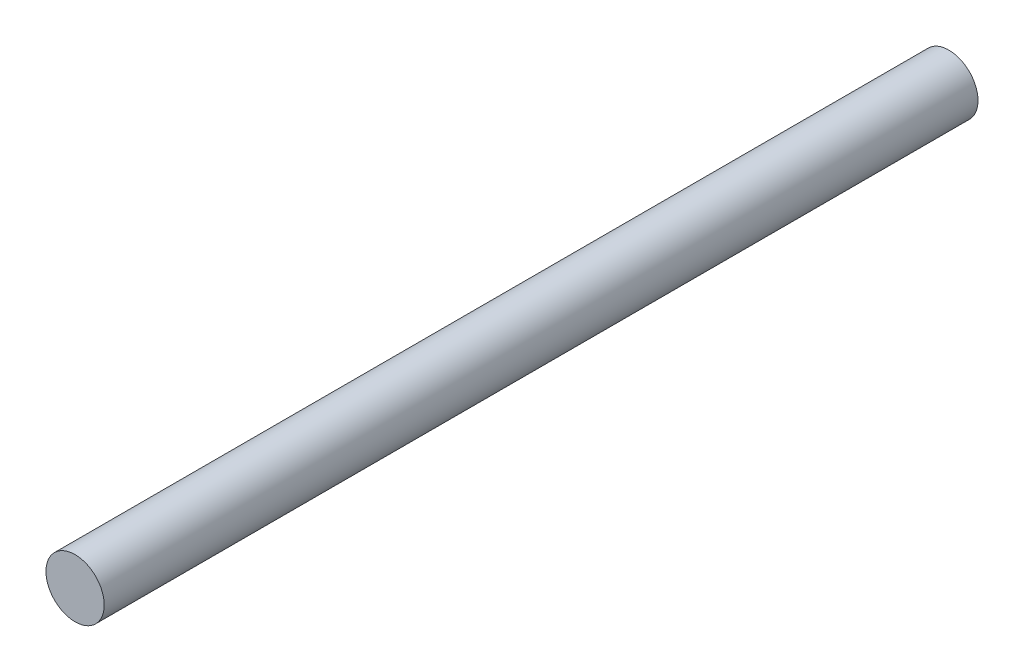
from build123d import *

# Parameters (mm, degrees)
SKETCH_1_R      = 1
EXTRUDE_1_DEPTH = 30


with BuildPart() as part:
    # ｽｹｯﾁ1 → ﾎﾞｽ - 押し出し1 (new body)
    with BuildSketch(Plane.XY):
        Circle(SKETCH_1_R)
    extrude(amount=EXTRUDE_1_DEPTH)


solid = part.part
